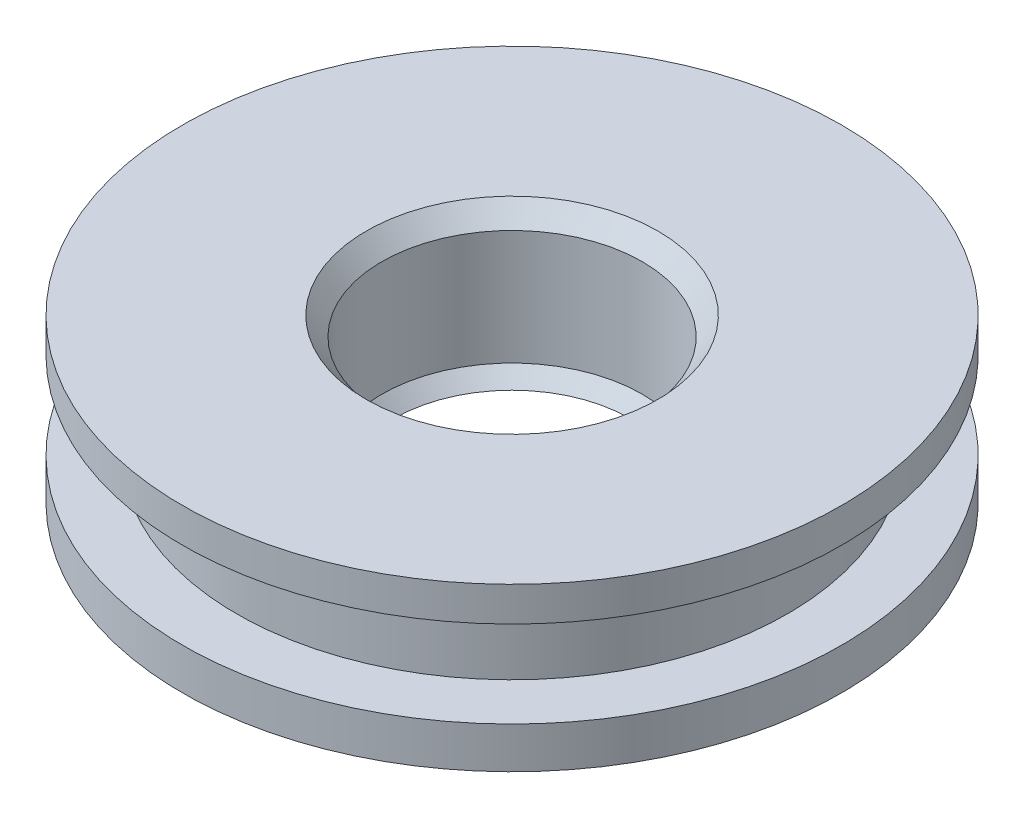
from build123d import *


with BuildPart() as part:
    # 草图1 → 旋转1 (revolve)
    with BuildSketch(Plane.XY, mode=Mode.PRIVATE) as revolve_1_sk:
        Polygon((0.822766623, 0.096387425), (1.435321087, 0.096387425), (1.435321087, 0.276387425), (1.1992489, 0.276387425), (1.1992489, 0.653435538), (1.435321087, 0.653435538), (1.435321087, 0.803435538), (0.635321087, 0.803435538), (0.567115044, 0.722150741), (0.567115044, 0.222150741), (0.513113462, 0.157794161), (0.670779617, 0.157794161), align=None)
    revolve(revolve_1_sk.sketch.rotate(Axis((0, -1.573227454, 0), (0, 1, 0)), 90), axis=Axis((0, -1.573227454, 0), (0, 1, 0)))


solid = part.part
